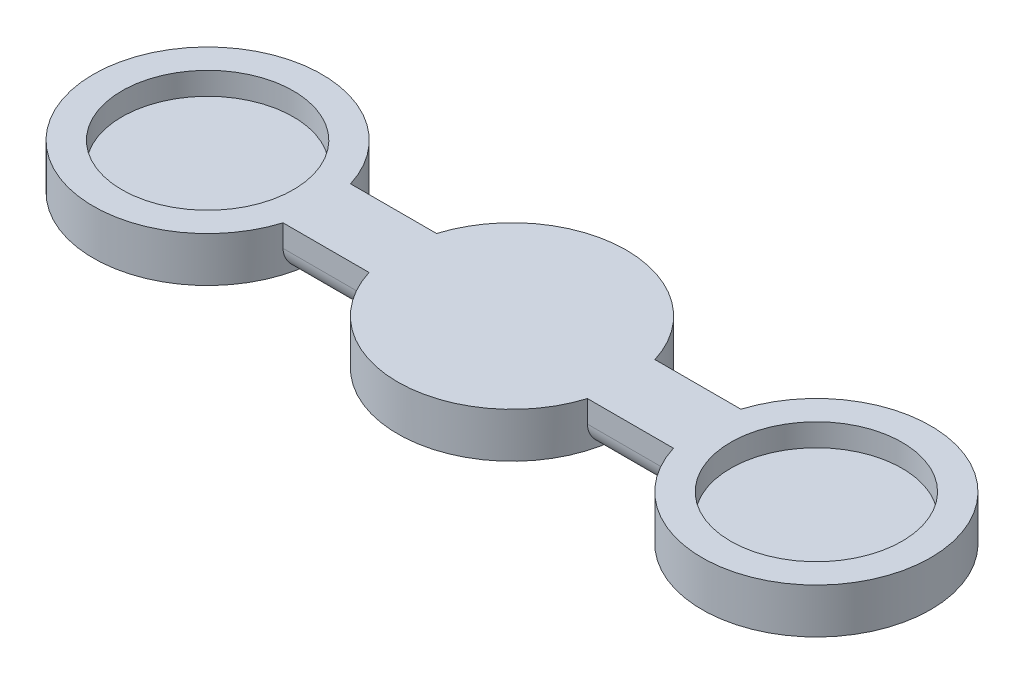
from build123d import *

# Parameters (mm, degrees)
SKETCH1_R           = 12.7
BOSS_EXTRUDE1_DEPTH = 5
SKETCH2_W           = 76.2
SKETCH2_H           = 7.5
BOSS_EXTRUDE2_DEPTH = 5
SKETCH3_R           = 12.7
BOSS_EXTRUDE3_DEPTH = 5
SKETCH4_R           = 9.525
CUT_EXTRUDE1_DEPTH  = 2.5
FILLET1_R           = 2.54


with BuildPart() as part:
    # Sketch1 → Boss-Extrude1 (new body)
    with BuildSketch(Plane(origin=(0, 0, 0), x_dir=(1, 0, 0), z_dir=(0, 1, 0))):
        with Locations(Location((0, 0, 0), (0, 0, 270))):
            Circle(SKETCH1_R)
    extrude(amount=BOSS_EXTRUDE1_DEPTH)

    # Sketch2 → Boss-Extrude2 (add)
    with BuildSketch(Plane(origin=(0, 5, 0), x_dir=(1, 0, 0), z_dir=(0, 1, 0))):
        Rectangle(SKETCH2_W, SKETCH2_H)
    extrude(amount=-BOSS_EXTRUDE2_DEPTH)

    # Sketch3 → Boss-Extrude3 (add)
    with BuildSketch(Plane(origin=(0, 5, 0), x_dir=(1, 0, 0), z_dir=(0, 1, 0))):
        with Locations((-33.819087464, 0)):
            Circle(SKETCH3_R)
    boss_extrude3 = extrude(amount=-BOSS_EXTRUDE3_DEPTH)

    # Sketch4 → Cut-Extrude1 (cut)
    with BuildSketch(Plane(origin=(0, 5, 0), x_dir=(1, 0, 0), z_dir=(0, 1, 0))):
        with Locations(Location((-33.819087464, 0, 0), (0, 0, 270))):
            Circle(SKETCH4_R)
    cut_extrude1 = extrude(amount=-CUT_EXTRUDE1_DEPTH, mode=Mode.SUBTRACT)

    # Mirror1: Boss-Extrude3, Cut-Extrude1 across plane
    add(boss_extrude3.mirror(Plane(origin=(0, 0, 0), x_dir=(0, 0, 1), z_dir=(1, 0, 0))))
    add(cut_extrude1.mirror(Plane(origin=(0, 0, 0), x_dir=(0, 0, 1), z_dir=(1, 0, 0))), mode=Mode.SUBTRACT)

    # Fillet1
    fillet1_edges = [part.edges().sort_by_distance(p)[0] for p in [
        (16.909543732, 0, -3.75),
        (-16.909543732, 0, 3.75),
        (-16.909543732, 0, -3.75),
        (16.909543732, 0, 3.75),
    ]]
    fillet(fillet1_edges, radius=FILLET1_R)


solid = part.part
